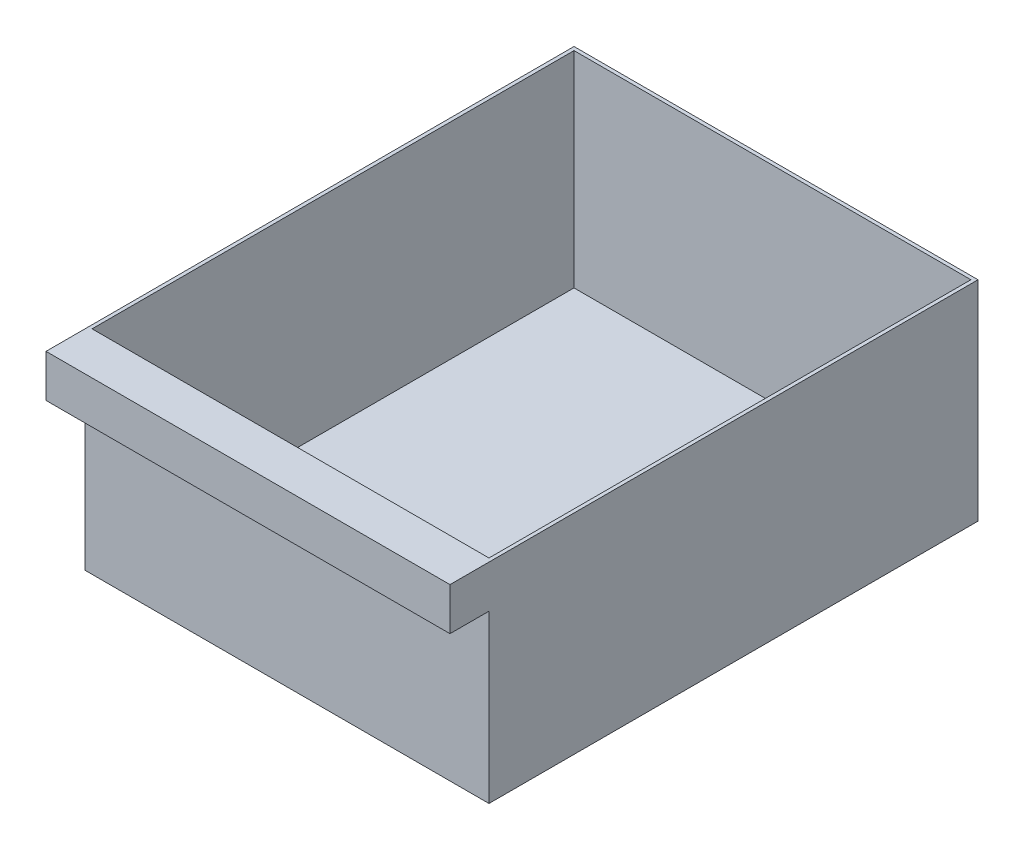
from build123d import *

# Parameters (mm, degrees)
SKETCH_4_W          = 114
SKETCH_4_H          = 138
EXTRUDE_1_DEPTH     = 59
SHELL_1_T           = -1
SKETCH_5_W          = 114
SKETCH_5_H          = 12
EXTRUDE_2_DEPTH     = 11
SKETCH_6_W          = 112
SKETCH_6_H          = 10
CUT_EXTRUDE_1_DEPTH = 11


with BuildPart() as part:
    # 草图4 → 凸台-拉伸1 (new body)
    with BuildSketch(Plane(origin=(0, 0, 0), x_dir=(1, 0, 0), z_dir=(0, 1, 0))):
        Rectangle(SKETCH_4_W, SKETCH_4_H)
    extrude(amount=EXTRUDE_1_DEPTH)

    # 抽壳1
    shell_1_openings = [part.faces().sort_by_distance(p)[0] for p in [
        (0, 59, 0),
    ]]
    offset(amount=SHELL_1_T, openings=shell_1_openings, kind=Kind.INTERSECTION)

    # 草图5 → 凸台-拉伸2 (add)
    with BuildSketch(Plane.XY.offset(69)):
        with Locations((0, 53)):
            Rectangle(SKETCH_5_W, SKETCH_5_H)
    extrude(amount=EXTRUDE_2_DEPTH)

    # 草图6 → 切除-拉伸1 (cut)
    with BuildSketch(Plane.XZ.offset(-47)):
        with Locations((0, 74)):
            Rectangle(SKETCH_6_W, SKETCH_6_H)
    extrude(amount=-CUT_EXTRUDE_1_DEPTH, mode=Mode.SUBTRACT)


solid = part.part
